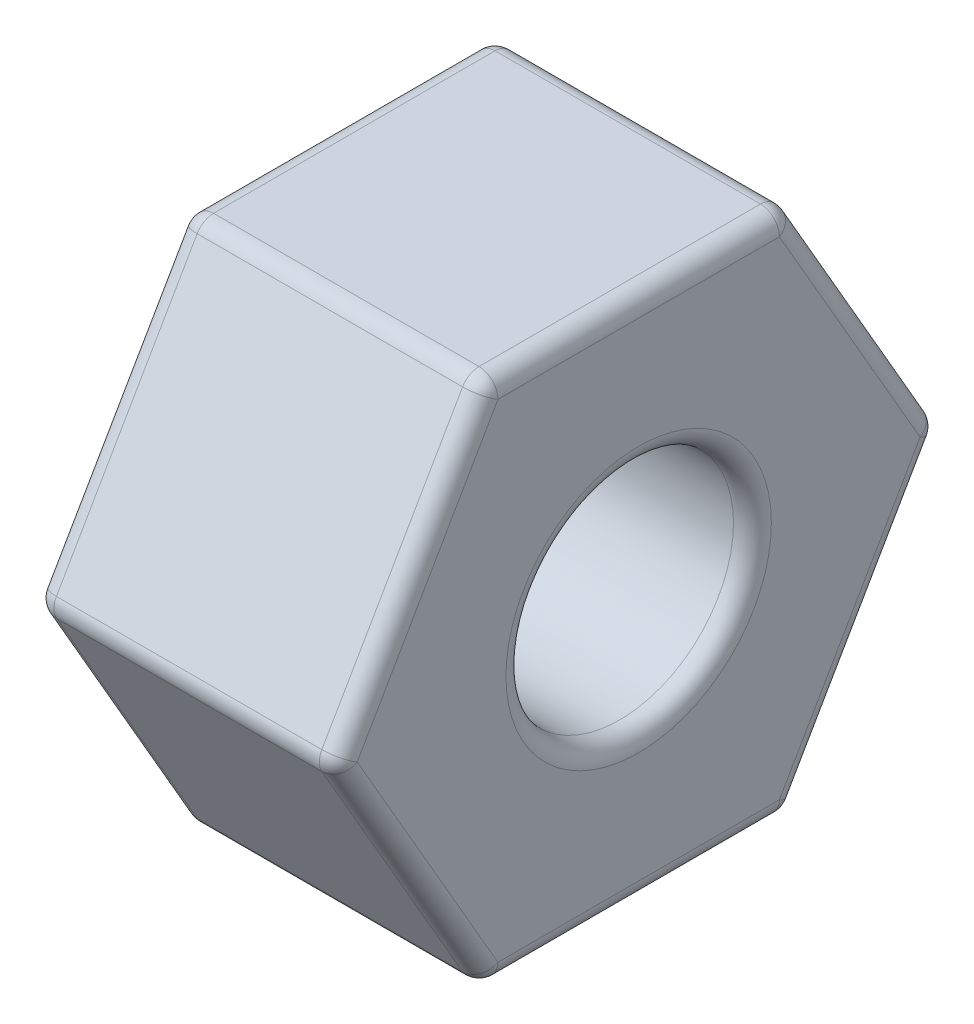
from build123d import *

# Parameters (mm, degrees)
SKETCH1_R           = 3
BOSS_EXTRUDE1_DEPTH = 8
FILLET1_R           = 0.5


with BuildPart() as part:
    # Sketch1 → Boss-Extrude1 (new body)
    with BuildSketch(Plane.YZ):
        Polygon((-6.92820323, -4), (0, -8), (6.92820323, -4), (6.92820323, 4), (0, 8), (-6.92820323, 4), align=None)
        Circle(SKETCH1_R, mode=Mode.SUBTRACT)
    extrude(amount=BOSS_EXTRUDE1_DEPTH)

    # Fillet1
    fillet1_edges = [part.edges().sort_by_distance(p)[0] for p in [
        (0, -3, 0),
        (8, -3, 0),
        (0, -6.92820323, 0),
        (0, -3.464101615, -6),
        (0, 3.464101615, -6),
        (0, 6.92820323, 0),
        (0, 3.464101615, 6),
        (0, -3.464101615, 6),
        (8, -6.92820323, 0),
        (8, -3.464101615, -6),
        (8, 3.464101615, -6),
        (8, 6.92820323, 0),
        (8, 3.464101615, 6),
        (8, -3.464101615, 6),
        (4, -6.92820323, 4),
        (4, 0, 8),
        (4, 6.92820323, -4),
        (4, 0, -8),
        (4, -6.92820323, -4),
        (4, 6.92820323, 4),
    ]]
    fillet(fillet1_edges, radius=FILLET1_R)


solid = part.part
